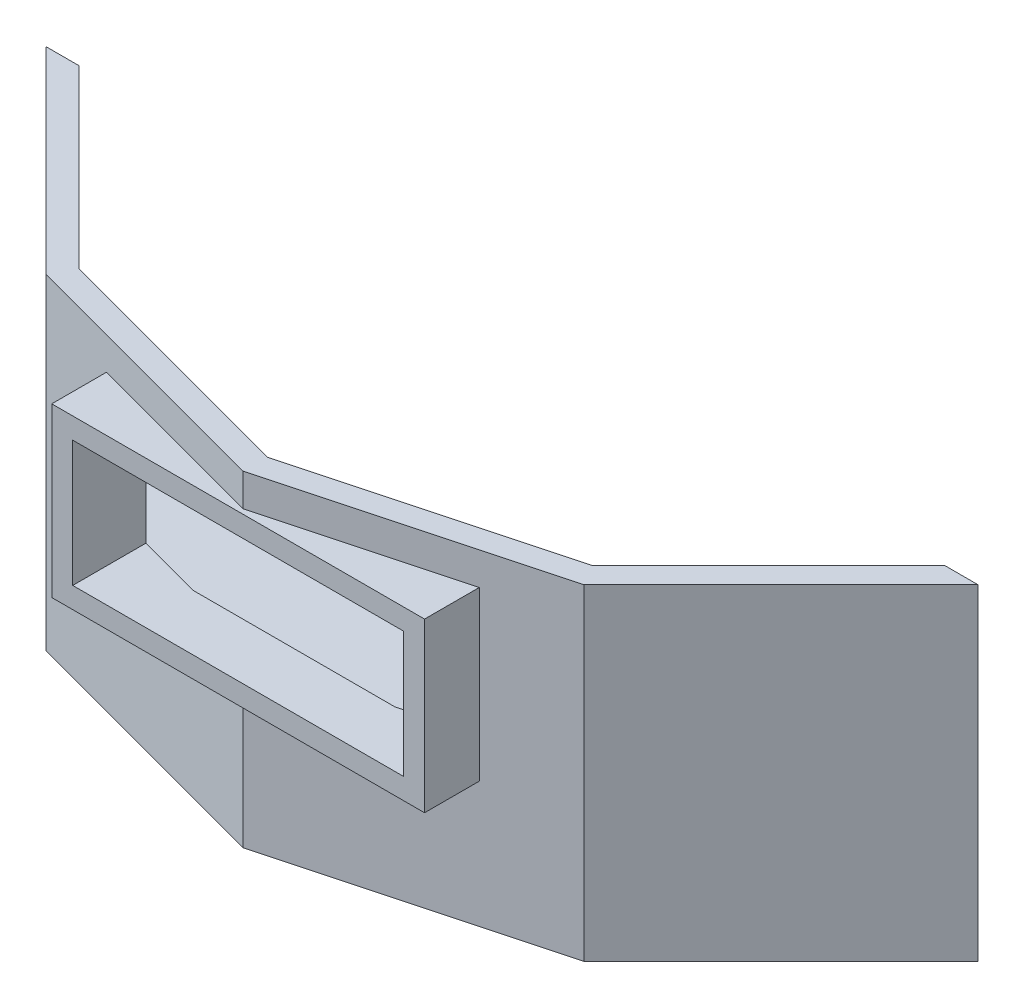
from build123d import *

# Parameters (mm, degrees)
BOSS_EXTRUDE1_DEPTH = 70
CUT_EXTRUDE1_DEPTH  = 65
SKETCH6_W           = 80
SKETCH6_H           = 36
BOSS_EXTRUDE2_DEPTH = 12
SKETCH7_W           = 71
SKETCH7_H           = 27
CUT_EXTRUDE2_DEPTH  = 20


with BuildPart() as part:
    # Sketch1 → Boss-Extrude1 (new body)
    with BuildSketch(Plane(origin=(0, 0, 0), x_dir=(1, 0, 0), z_dir=(0, 1, 0))):
        Polygon((57.735026919, -100), (100, -57.735026919), (-100, -57.735026919), (-57.735026919, -100), (0, -115.470053838), align=None)
    extrude(amount=BOSS_EXTRUDE1_DEPTH)

    # Sketch4 → Cut-Extrude1 (cut)
    with BuildSketch(Plane(origin=(0, 70, 0), x_dir=(1, 0, 0), z_dir=(0, 1, 0))):
        Polygon((110.293672936, 0), (95.517122639, 55.146836468), (55.146836468, 95.517122639), (0, 110.293672936), (-55.146836468, 95.517122639), (-95.517122639, 55.146836468), (-110.293672936, 0), (-95.517122639, -55.146836468), (-55.146836468, -95.517122639), (0, -110.293672936), (55.146836468, -95.517122639), (95.517122639, -55.146836468), align=None)
    extrude(amount=-CUT_EXTRUDE1_DEPTH, mode=Mode.SUBTRACT)

    # Sketch6 → Boss-Extrude2 (add)
    with BuildSketch(Plane.XY.offset(104.5)):
        with Locations((0, 45)):
            Rectangle(SKETCH6_W, SKETCH6_H)
    extrude(amount=BOSS_EXTRUDE2_DEPTH)

    # Sketch7 → Cut-Extrude2 (cut)
    with BuildSketch(Plane.XY.offset(116.5)):
        with Locations((0, 45)):
            Rectangle(SKETCH7_W, SKETCH7_H)
    extrude(amount=-CUT_EXTRUDE2_DEPTH, mode=Mode.SUBTRACT)


solid = part.part
